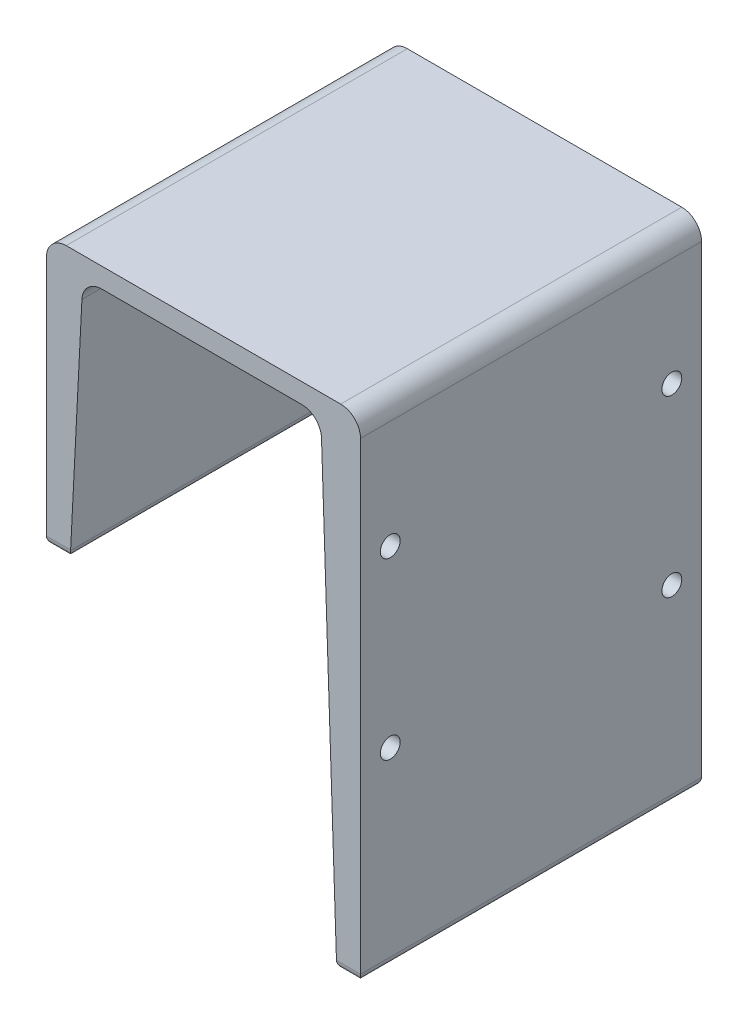
from build123d import *

# Parameters (mm, degrees)
BOSS_EXTRUDE1_DEPTH = 43
CUT_EXTRUDE1_REACH  = 69.604
SKETCH2_R           = 1.25
FILLET1_R           = 2.5
FILLET2_R           = 2.5
FILLET3_R           = 1
FILLET4_R           = 1


with BuildPart() as part:
    # Sketch1 → Boss-Extrude1 (new body)
    with BuildSketch(Plane.XY):
        Polygon((0, 0), (1.6, 31.458886043), (31.6, 31.458886043), (33.6, -28.041113957), (36.6, -28.041113957), (36.6, 33.958886043), (-3, 33.958886043), (-3, 0), align=None)
    extrude(amount=-BOSS_EXTRUDE1_DEPTH)

    # Cut-Extrude1: up to this plane
    cut_extrude1_end = Plane(origin=(31.6, 31.458886043, -43), z_dir=(-0.9994355464166094, -0.03359447214845748, 0))
    # Sketch2 → Cut-Extrude1 (cut, up to the surface)
    with BuildSketch(Plane(origin=(36.6, 0, 0), x_dir=(0, 0, -1), z_dir=(1, 0, 0)), mode=Mode.PRIVATE) as cut_extrude1_sk1:
        with Locations(Location((39.25, 17.819052722, 0), (0, 0, 90))):
            Circle(SKETCH2_R)
    cut_extrude1_tool1 = split(extrude(cut_extrude1_sk1.sketch, amount=-CUT_EXTRUDE1_REACH, mode=Mode.PRIVATE), bisect_by=cut_extrude1_end, keep=Keep.BOTH, mode=Mode.PRIVATE)
    add(cut_extrude1_tool1.solids().sort_by_distance((36.6, 17.819053, -39.25))[0], mode=Mode.SUBTRACT)
    # Sketch2 → Cut-Extrude1 (cut, up to the surface)
    with BuildSketch(Plane(origin=(36.6, 0, 0), x_dir=(0, 0, -1), z_dir=(1, 0, 0)), mode=Mode.PRIVATE) as cut_extrude1_sk2:
        with Locations(Location((39.25, -4.180947278, 0), (0, 0, 90))):
            Circle(SKETCH2_R)
    cut_extrude1_tool2 = split(extrude(cut_extrude1_sk2.sketch, amount=-CUT_EXTRUDE1_REACH, mode=Mode.PRIVATE), bisect_by=cut_extrude1_end, keep=Keep.BOTH, mode=Mode.PRIVATE)
    add(cut_extrude1_tool2.solids().sort_by_distance((36.6, -4.180947, -39.25))[0], mode=Mode.SUBTRACT)
    # Sketch2 → Cut-Extrude1 (cut, up to the surface)
    with BuildSketch(Plane(origin=(36.6, 0, 0), x_dir=(0, 0, -1), z_dir=(1, 0, 0)), mode=Mode.PRIVATE) as cut_extrude1_sk3:
        with Locations(Location((3.75, -4.180947278, 0), (0, 0, 270))):
            Circle(SKETCH2_R)
    cut_extrude1_tool3 = split(extrude(cut_extrude1_sk3.sketch, amount=-CUT_EXTRUDE1_REACH, mode=Mode.PRIVATE), bisect_by=cut_extrude1_end, keep=Keep.BOTH, mode=Mode.PRIVATE)
    add(cut_extrude1_tool3.solids().sort_by_distance((36.6, -4.180947, -3.75))[0], mode=Mode.SUBTRACT)
    # Sketch2 → Cut-Extrude1 (cut, up to the surface)
    with BuildSketch(Plane(origin=(36.6, 0, 0), x_dir=(0, 0, -1), z_dir=(1, 0, 0)), mode=Mode.PRIVATE) as cut_extrude1_sk4:
        with Locations(Location((3.75, 17.819052722, 0), (0, 0, 270))):
            Circle(SKETCH2_R)
    cut_extrude1_tool4 = split(extrude(cut_extrude1_sk4.sketch, amount=-CUT_EXTRUDE1_REACH, mode=Mode.PRIVATE), bisect_by=cut_extrude1_end, keep=Keep.BOTH, mode=Mode.PRIVATE)
    add(cut_extrude1_tool4.solids().sort_by_distance((36.6, 17.819053, -3.75))[0], mode=Mode.SUBTRACT)

    # Fillet1
    fillet1_edges = [part.edges().sort_by_distance(p)[0] for p in [
        (31.6, 31.458886043, -21.5),
        (1.6, 31.458886043, -21.5),
    ]]
    fillet(fillet1_edges, radius=FILLET1_R)

    # Fillet2
    fillet2_edges = [part.edges().sort_by_distance(p)[0] for p in [
        (-3, 33.958886043, -21.5),
        (36.6, 33.958886043, -21.5),
    ]]
    fillet(fillet2_edges, radius=FILLET2_R)

    # Fillet3
    fillet3_edges = [part.edges().sort_by_distance(p)[0] for p in [
        (-1.5, 0, 0),
        (-3, 0, -21.5),
        (0, 0, -21.5),
        (-1.5, 0, -43),
    ]]
    fillet(fillet3_edges, radius=FILLET3_R)

    # Fillet4
    fillet4_edges = [part.edges().sort_by_distance(p)[0] for p in [
        (36.6, -28.041113957, -21.5),
        (33.6, -28.041113957, -21.5),
        (35.1, -28.041113957, -43),
        (35.1, -28.041113957, 0),
    ]]
    fillet(fillet4_edges, radius=FILLET4_R)


solid = part.part
